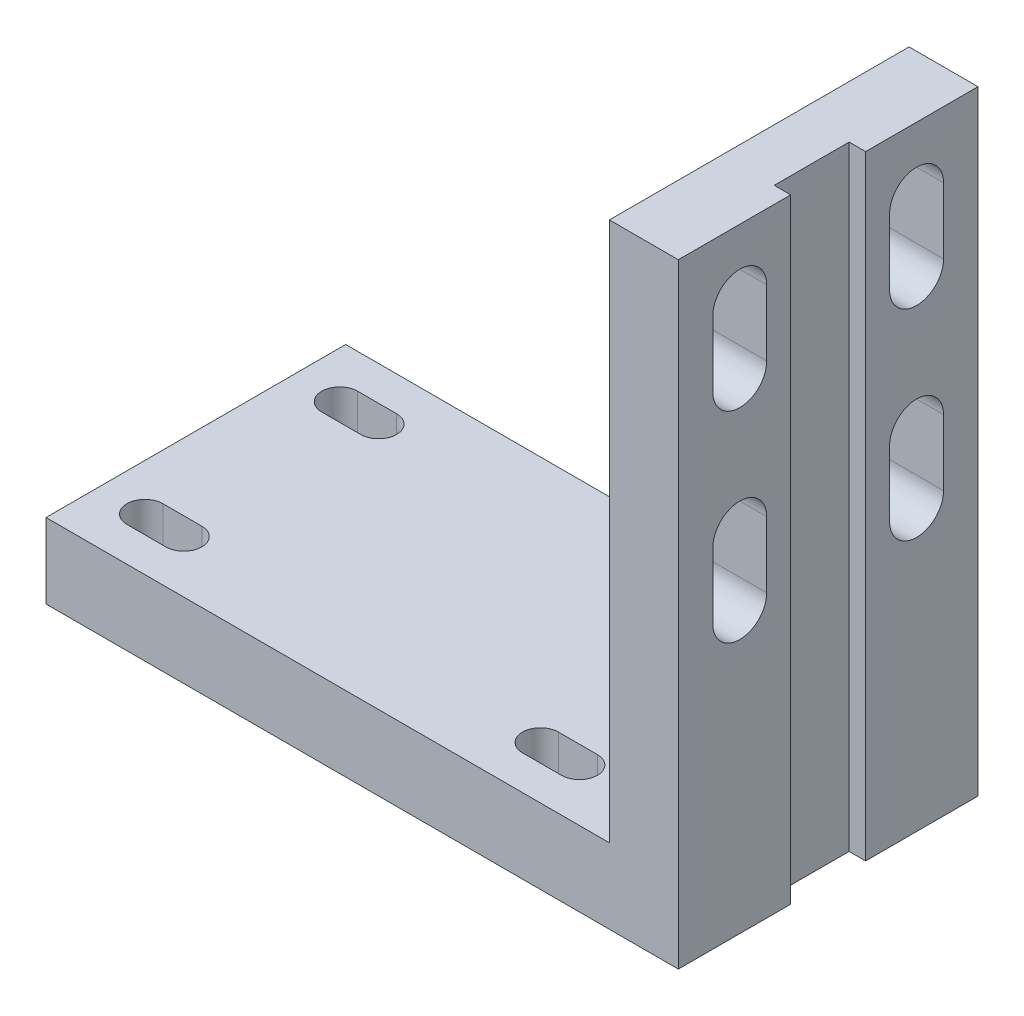
from build123d import *

# Parameters (mm, degrees)
SKETCH_1_W          = 23
SKETCH_1_H          = 205
EXTRUDE_1_DEPTH     = 100
SKETCH_3_W          = 188
SKETCH_3_H          = 25
EXTRUDE_3_DEPTH     = 100
CUT_EXTRUDE_1_REACH = 312.719
CUT_EXTRUDE_2_REACH = 312.719
SKETCH_6_W          = 25
SKETCH_6_H          = 205
CUT_EXTRUDE_3_DEPTH = 5.5


with BuildPart() as part:
    # 草图1 → 凸台-拉伸1 (new body)
    with BuildSketch(Plane.XY):
        with Locations((-11.5, -102.5)):
            Rectangle(SKETCH_1_W, SKETCH_1_H)
    extrude(amount=EXTRUDE_1_DEPTH)

    # 草图3 → 凸台-拉伸3 (add)
    with BuildSketch(Plane.XY.offset(100)):
        with Locations((-117, -192.5)):
            Rectangle(SKETCH_3_W, SKETCH_3_H)
    extrude(amount=-EXTRUDE_3_DEPTH)

    # 草图4 → 切除-拉伸1 (cut, up to next)
    with BuildSketch(Plane(origin=(0, 0, 0), x_dir=(0, 0, -1), z_dir=(1, 0, 0)), mode=Mode.PRIVATE) as cut_extrude_1_sk1:
        with BuildLine():
            Line((-70.5, -22), (-70.5, -44))
            ThreePointArc((-70.5, -44), (-79.5, -53), (-88.5, -44))
            Line((-88.5, -44), (-88.5, -22))
            ThreePointArc((-88.5, -22), (-79.5, -13), (-70.5, -22))
        make_face()
    cut_extrude_1_tool1 = extrude(cut_extrude_1_sk1.sketch, amount=-CUT_EXTRUDE_1_REACH, mode=Mode.PRIVATE) & part.part
    # 草图4 → 切除-拉伸1 (cut, up to next)
    with BuildSketch(Plane(origin=(0, 0, 0), x_dir=(0, 0, -1), z_dir=(1, 0, 0)), mode=Mode.PRIVATE) as cut_extrude_1_sk2:
        with BuildLine():
            Line((-11.5, -22), (-11.5, -44))
            ThreePointArc((-11.5, -44), (-20.5, -53), (-29.5, -44))
            Line((-29.5, -44), (-29.5, -22))
            ThreePointArc((-29.5, -22), (-20.5, -13), (-11.5, -22))
        make_face()
    cut_extrude_1_tool2 = extrude(cut_extrude_1_sk2.sketch, amount=-CUT_EXTRUDE_1_REACH, mode=Mode.PRIVATE) & part.part
    # 草图4 → 切除-拉伸1 (cut, up to next)
    with BuildSketch(Plane(origin=(0, 0, 0), x_dir=(0, 0, -1), z_dir=(1, 0, 0)), mode=Mode.PRIVATE) as cut_extrude_1_sk3:
        with BuildLine():
            Line((-70.5, -89), (-70.5, -111))
            ThreePointArc((-70.5, -111), (-79.5, -120), (-88.5, -111))
            Line((-88.5, -111), (-88.5, -89))
            ThreePointArc((-88.5, -89), (-79.5, -80), (-70.5, -89))
        make_face()
    cut_extrude_1_tool3 = extrude(cut_extrude_1_sk3.sketch, amount=-CUT_EXTRUDE_1_REACH, mode=Mode.PRIVATE) & part.part
    # 草图4 → 切除-拉伸1 (cut, up to next)
    with BuildSketch(Plane(origin=(0, 0, 0), x_dir=(0, 0, -1), z_dir=(1, 0, 0)), mode=Mode.PRIVATE) as cut_extrude_1_sk4:
        with BuildLine():
            Line((-11.5, -89), (-11.5, -111))
            ThreePointArc((-11.5, -111), (-20.5, -120), (-29.5, -111))
            Line((-29.5, -111), (-29.5, -89))
            ThreePointArc((-29.5, -89), (-20.5, -80), (-11.5, -89))
        make_face()
    cut_extrude_1_tool4 = extrude(cut_extrude_1_sk4.sketch, amount=-CUT_EXTRUDE_1_REACH, mode=Mode.PRIVATE) & part.part
    add(cut_extrude_1_tool1.solids().sort_by_distance((0, -33, 79.5))[0], mode=Mode.SUBTRACT)
    add(cut_extrude_1_tool2.solids().sort_by_distance((0, -33, 20.5))[0], mode=Mode.SUBTRACT)
    add(cut_extrude_1_tool3.solids().sort_by_distance((0, -100, 79.5))[0], mode=Mode.SUBTRACT)
    add(cut_extrude_1_tool4.solids().sort_by_distance((0, -100, 20.5))[0], mode=Mode.SUBTRACT)

    # 草图5 → 切除-拉伸2 (cut, up to next)
    with BuildSketch(Plane.XZ.offset(205), mode=Mode.PRIVATE) as cut_extrude_2_sk1:
        with BuildLine():
            Line((-195.5, 88.5), (-182.5, 88.5))
            ThreePointArc((-182.5, 88.5), (-176.5, 82.5), (-182.5, 76.5))
            Line((-182.5, 76.5), (-195.5, 76.5))
            ThreePointArc((-195.5, 76.5), (-201.5, 82.5), (-195.5, 88.5))
        make_face()
    cut_extrude_2_tool1 = extrude(cut_extrude_2_sk1.sketch, amount=-CUT_EXTRUDE_2_REACH, mode=Mode.PRIVATE) & part.part
    # 草图5 → 切除-拉伸2 (cut, up to next)
    with BuildSketch(Plane.XZ.offset(205), mode=Mode.PRIVATE) as cut_extrude_2_sk2:
        with BuildLine():
            Line((-63.5, 88.5), (-50.5, 88.5))
            ThreePointArc((-50.5, 88.5), (-44.5, 82.5), (-50.5, 76.5))
            Line((-50.5, 76.5), (-63.5, 76.5))
            ThreePointArc((-63.5, 76.5), (-69.5, 82.5), (-63.5, 88.5))
        make_face()
    cut_extrude_2_tool2 = extrude(cut_extrude_2_sk2.sketch, amount=-CUT_EXTRUDE_2_REACH, mode=Mode.PRIVATE) & part.part
    # 草图5 → 切除-拉伸2 (cut, up to next)
    with BuildSketch(Plane.XZ.offset(205), mode=Mode.PRIVATE) as cut_extrude_2_sk3:
        with BuildLine():
            Line((-195.5, 23.5), (-182.5, 23.5))
            ThreePointArc((-182.5, 23.5), (-176.5, 17.5), (-182.5, 11.5))
            Line((-182.5, 11.5), (-195.5, 11.5))
            ThreePointArc((-195.5, 11.5), (-201.5, 17.5), (-195.5, 23.5))
        make_face()
    cut_extrude_2_tool3 = extrude(cut_extrude_2_sk3.sketch, amount=-CUT_EXTRUDE_2_REACH, mode=Mode.PRIVATE) & part.part
    # 草图5 → 切除-拉伸2 (cut, up to next)
    with BuildSketch(Plane.XZ.offset(205), mode=Mode.PRIVATE) as cut_extrude_2_sk4:
        with BuildLine():
            Line((-63.5, 23.5), (-50.5, 23.5))
            ThreePointArc((-50.5, 23.5), (-44.5, 17.5), (-50.5, 11.5))
            Line((-50.5, 11.5), (-63.5, 11.5))
            ThreePointArc((-63.5, 11.5), (-69.5, 17.5), (-63.5, 23.5))
        make_face()
    cut_extrude_2_tool4 = extrude(cut_extrude_2_sk4.sketch, amount=-CUT_EXTRUDE_2_REACH, mode=Mode.PRIVATE) & part.part
    add(cut_extrude_2_tool1.solids().sort_by_distance((-189, -205, 82.5))[0], mode=Mode.SUBTRACT)
    add(cut_extrude_2_tool2.solids().sort_by_distance((-57, -205, 82.5))[0], mode=Mode.SUBTRACT)
    add(cut_extrude_2_tool3.solids().sort_by_distance((-189, -205, 17.5))[0], mode=Mode.SUBTRACT)
    add(cut_extrude_2_tool4.solids().sort_by_distance((-57, -205, 17.5))[0], mode=Mode.SUBTRACT)

    # 草图6 → 切除-拉伸3 (cut)
    with BuildSketch(Plane(origin=(0, 0, 0), x_dir=(0, 0, -1), z_dir=(1, 0, 0))):
        with Locations((-50, -102.5)):
            Rectangle(SKETCH_6_W, SKETCH_6_H)
    extrude(amount=-CUT_EXTRUDE_3_DEPTH, mode=Mode.SUBTRACT)


solid = part.part
